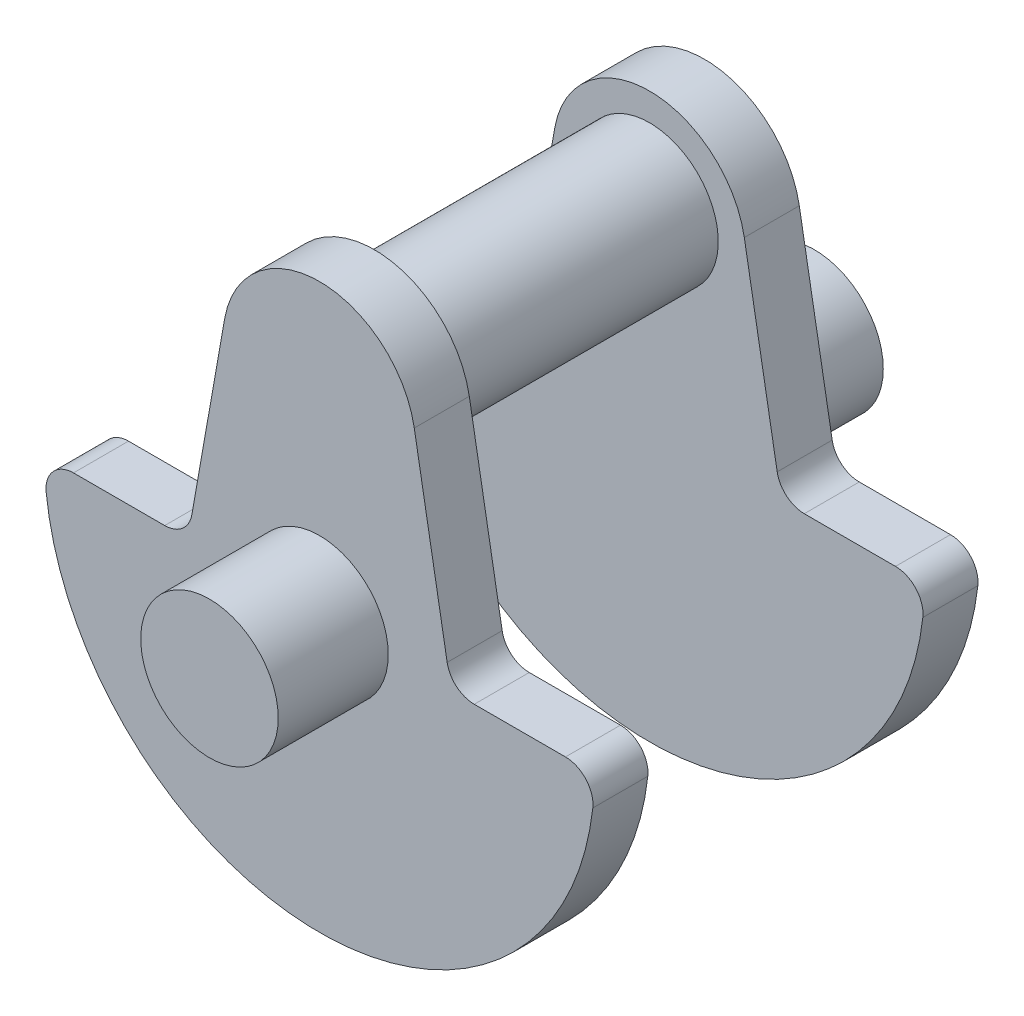
from build123d import *

# Parameters (mm, degrees)
SKETCH1_R            = 12.5
BOSS_EXTRUDE1_DEPTH  = 10
FILLET1_R            = 5
SKETCH1_2_R          = 12.5
BOSS_EXTRUDE2_DEPTH  = 30
SKETCH2_R            = 12.5
BOSS_EXTRUDE3_DEPTH  = 50
FILLET1_OF_MIRROR1_R = 5


with BuildPart() as part:
    # Sketch1 → Boss-Extrude1 (new body)
    with BuildSketch(Plane.XY):
        with BuildLine():
            Line((-50, 0), (-23.941410033, 0))
            Line((-23.941410033, 0), (-17.234135678, 38.038843109))
            ThreePointArc((-17.234135678, 38.038843109), (0, 52.5), (17.234135678, 38.038843109))
            Line((17.234135678, 38.038843109), (23.941410033, 0))
            Line((23.941410033, 0), (50, 0))
            ThreePointArc((50, 0), (0, -50), (-50, 0))
        make_face()
        Circle(SKETCH1_R, mode=Mode.SUBTRACT)
    boss_extrude1 = extrude(amount=BOSS_EXTRUDE1_DEPTH)

    # Fillet1
    fillet1_edges = [part.edges().sort_by_distance(p)[0] for p in [
        (23.941410033, 0, 5),
        (50, 0, 5),
        (-50, 0, 5),
        (-23.941410033, 0, 5),
    ]]
    fillet(fillet1_edges, radius=FILLET1_R)

    # Sketch1<2> → Boss-Extrude2 (add)
    with BuildSketch(Plane.XY):
        Circle(SKETCH1_2_R)
    boss_extrude2 = extrude(amount=BOSS_EXTRUDE2_DEPTH)

    # Sketch2 → Boss-Extrude3 (add)
    with BuildSketch(Plane(origin=(0, 0, 0), x_dir=(-1, 0, 0), z_dir=(0, 0, -1))):
        with Locations((0, 35)):
            Circle(SKETCH2_R)
    extrude(amount=BOSS_EXTRUDE3_DEPTH)

    # Mirror1: Boss-Extrude1, Boss-Extrude2 across plane
    add(boss_extrude1.mirror(Plane(origin=(0, 0, -25), x_dir=(1, 0, 0), z_dir=(0, 0, -1))))
    add(boss_extrude2.mirror(Plane(origin=(0, 0, -25), x_dir=(1, 0, 0), z_dir=(0, 0, -1))))

    # Fillet1 of Mirror1
    fillet1_of_mirror1_edges = [part.edges().sort_by_distance(p)[0] for p in [
        (23.941410033, 0, -55),
        (50, 0, -55),
        (-50, 0, -55),
        (-23.941410033, 0, -55),
    ]]
    fillet(fillet1_of_mirror1_edges, radius=FILLET1_OF_MIRROR1_R)


solid = part.part
